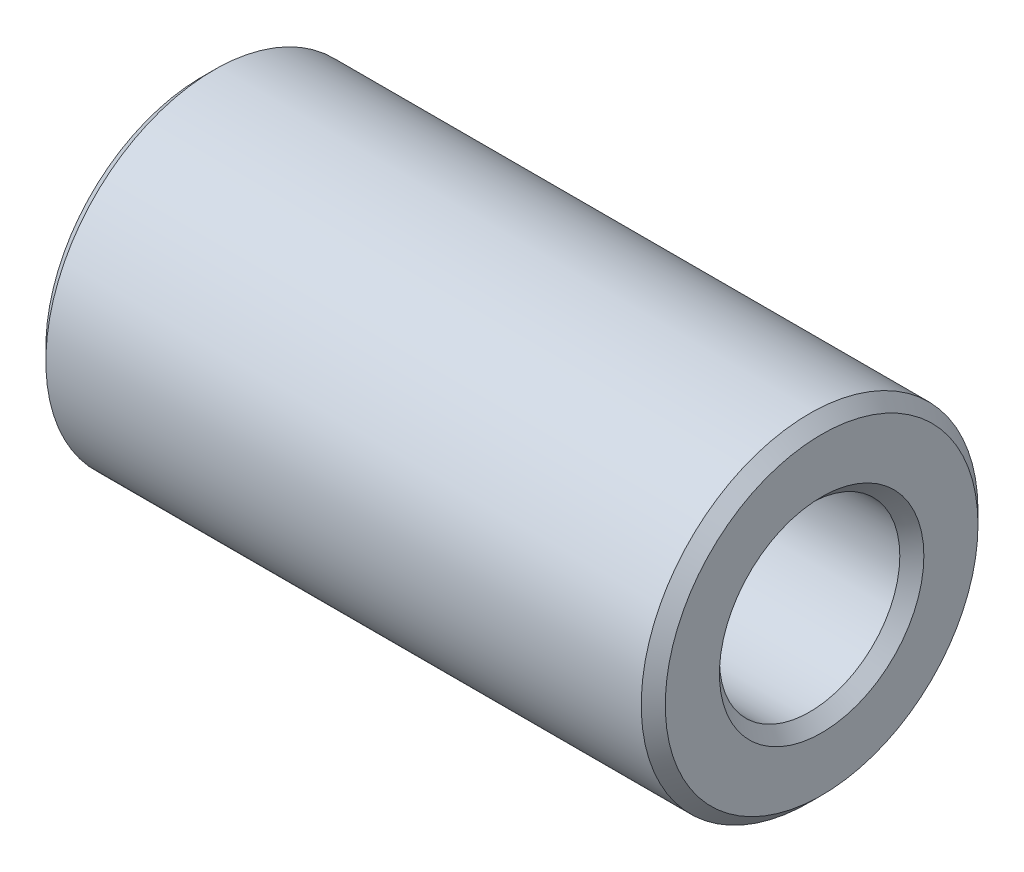
from build123d import *

# Parameters (mm, degrees)
SKETCH1_R           = 14
SKETCH1_R_2         = 7.5
BOSS_EXTRUDE1_DEPTH = 25.75
CHAMFER1_SIZE       = 1


with BuildPart() as part:
    # Sketch1 → Boss-Extrude1 (new, symmetric)
    with BuildSketch(Plane(origin=(0, 0, 0), x_dir=(0, -1, 0), z_dir=(1, 0, 0))):
        with Locations(Location((0, 0, 0), (0, 0, 90))):
            Circle(SKETCH1_R)
        with Locations(Location((0, 0, 0), (0, 0, 90))):
            Circle(SKETCH1_R_2, mode=Mode.SUBTRACT)
    extrude(amount=BOSS_EXTRUDE1_DEPTH, both=True)

    # Chamfer1
    chamfer1_edges = [part.edges().sort_by_distance(p)[0] for p in [
        (-25.75, 0, 14),
        (25.75, 0, 14),
        (-25.75, 0, 7.5),
        (25.75, 0, 7.5),
    ]]
    chamfer(chamfer1_edges, length=CHAMFER1_SIZE)


solid = part.part
